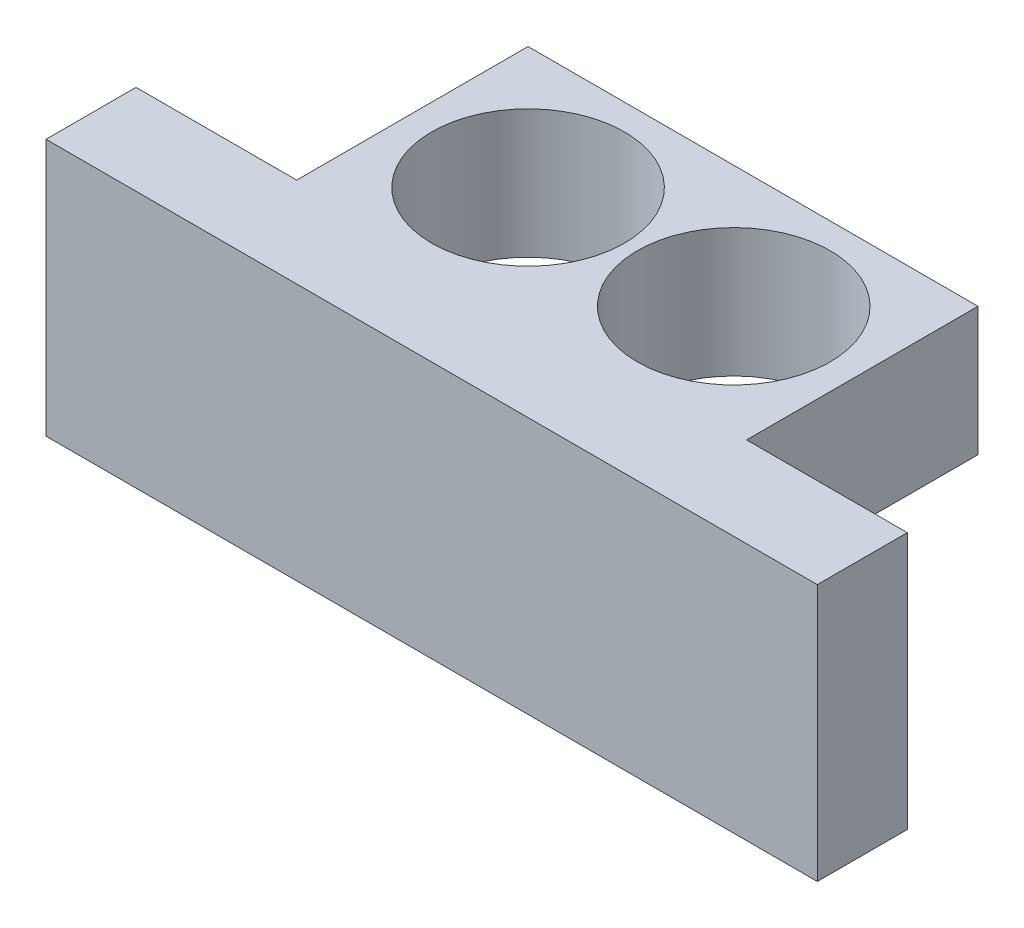
from build123d import *

# Parameters (mm, degrees)
SKETCH3_W           = 30
SKETCH3_H           = 12.5
BOSS_EXTRUDE1_DEPTH = 10
SKETCH6_R           = 3.75
SKETCH6_W           = 6.25
SKETCH6_H           = 9
CUT_EXTRUDE2_DEPTH  = 10
SKETCH8_W           = 17.5
SKETCH8_H           = 9
CUT_EXTRUDE4_DEPTH  = 5


with BuildPart() as part:
    # Sketch3 → Boss-Extrude1 (new body)
    with BuildSketch(Plane(origin=(0, 0, 0), x_dir=(1, 0, 0), z_dir=(0, 1, 0))):
        Rectangle(SKETCH3_W, SKETCH3_H)
    extrude(amount=BOSS_EXTRUDE1_DEPTH)

    # Sketch6 → Cut-Extrude2 (cut)
    with BuildSketch(Plane(origin=(0, 10, 0), x_dir=(1, 0, 0), z_dir=(0, 1, 0))):
        with Locations(Location((-4, 1.5, 0), (0, 0, 270))):
            Circle(SKETCH6_R)
        with Locations(Location((4, 1.5, 0), (0, 0, 270))):
            Circle(SKETCH6_R)
        with Locations((-11.875, 1.75)):
            Rectangle(SKETCH6_W, SKETCH6_H)
        with Locations((11.875, 1.75)):
            Rectangle(SKETCH6_W, SKETCH6_H)
    extrude(amount=-CUT_EXTRUDE2_DEPTH, mode=Mode.SUBTRACT)

    # Sketch8 → Cut-Extrude4 (cut)
    with BuildSketch(Plane.XZ):
        with Locations((0, -1.75)):
            Rectangle(SKETCH8_W, SKETCH8_H)
    extrude(amount=-CUT_EXTRUDE4_DEPTH, mode=Mode.SUBTRACT)


solid = part.part
